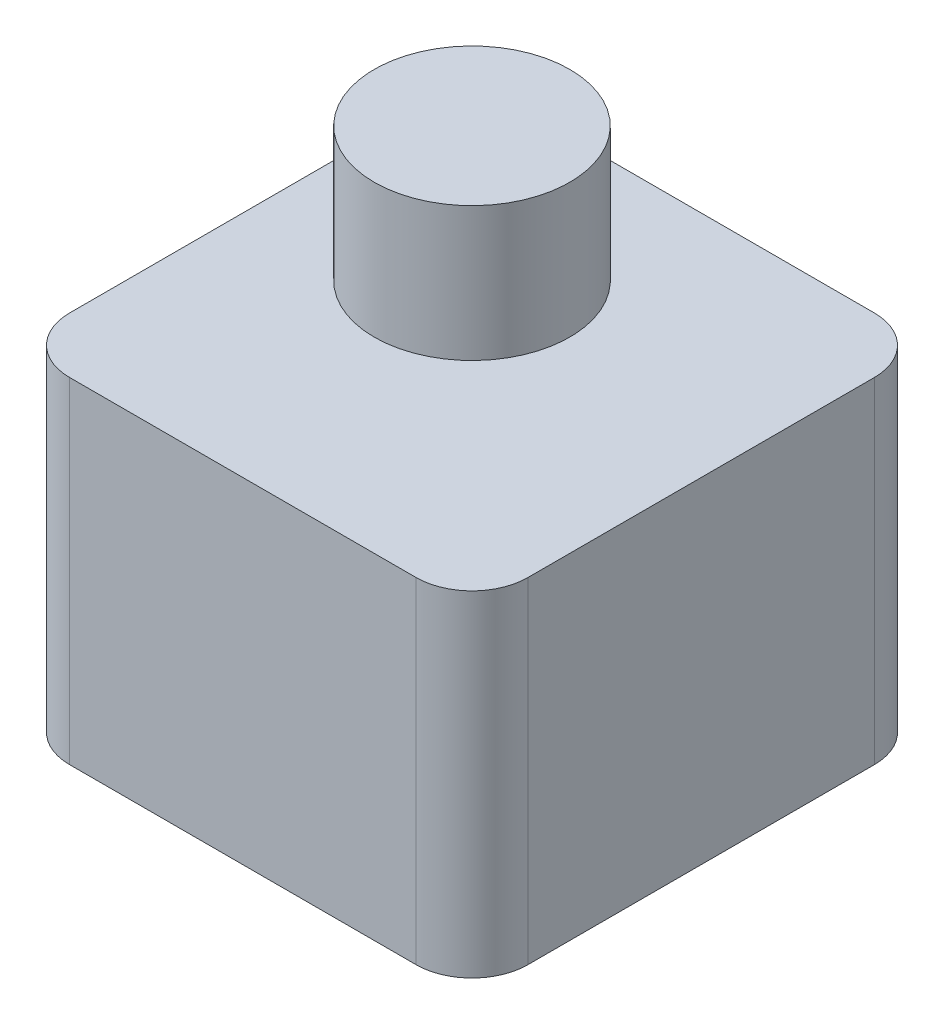
from build123d import *

# Parameters (mm, degrees)
SALIENTE_EXTRUIR2_DEPTH = 30
CROQUIS3_R              = 1.5
SALIENTE_EXTRUIR3_DEPTH = 17
CROQUIS6_R              = 8.75
SALIENTE_EXTRUIR4_DEPTH = 12


with BuildPart() as part:
    # Croquis2 → Saliente-Extruir2 (new body)
    with BuildSketch(Plane(origin=(0, 0, 0), x_dir=(1, 0, 0), z_dir=(0, 1, 0))):
        with BuildLine():
            Line((5, 41), (36, 41))
            ThreePointArc((36, 41), (39.535533906, 39.535533906), (41, 36))
            Line((41, 36), (41, 5))
            ThreePointArc((41, 5), (39.535533906, 1.464466094), (36, 0))
            Line((36, 0), (5, 0))
            ThreePointArc((5, 0), (1.464466094, 1.464466094), (0, 5))
            Line((0, 5), (0, 36))
            ThreePointArc((0, 36), (1.464466094, 39.535533906), (5, 41))
        make_face()
    extrude(amount=SALIENTE_EXTRUIR2_DEPTH)


with BuildPart() as body_2:
    # Croquis3 → Saliente-Extruir3 (new body)
    with BuildSketch(Plane(origin=(0, 30, 0), x_dir=(1, 0, 0), z_dir=(0, 1, 0))):
        with Locations(Location((20.5, 20.5, 0), (0, 0, 270))):
            Circle(CROQUIS3_R)
    extrude(amount=SALIENTE_EXTRUIR3_DEPTH)

    # Croquis6 → Saliente-Extruir4 (add)
    with BuildSketch(Plane(origin=(0, 35, 0), x_dir=(1, 0, 0), z_dir=(0, 1, 0))):
        with Locations(Location((20.5, 20.5, 0), (0, 0, 270))):
            Circle(CROQUIS6_R)
    extrude(amount=SALIENTE_EXTRUIR4_DEPTH)


solid = Compound([part.part, body_2.part])
